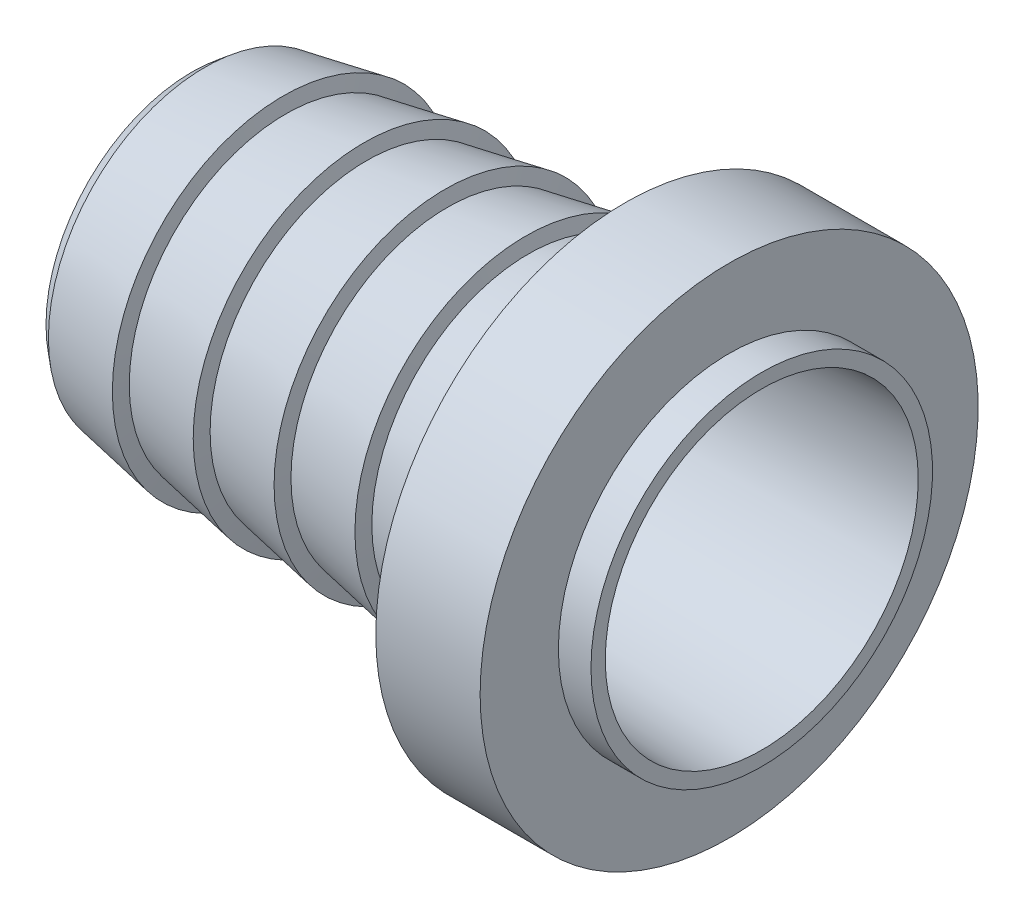
from build123d import *


with BuildPart() as part:
    # Sketch1 → Revolve2 (revolve)
    with BuildSketch(Plane(origin=(0, 0, 0), x_dir=(1, 0, 0), z_dir=(0, 1, 0)), mode=Mode.PRIVATE) as revolve2_sk:
        Polygon((0, 10.095412493), (0, 11.183615724), (1, 12), (7, 13.095445115), (7.2, 12), (13.2, 13.095445115), (13.4, 12), (19.4, 13.095445115), (19.6, 12), (25.6, 13.095445115), (25.8, 12), (31.8, 13.095445115), (33.2, 13.095445115), (33.2, 19.095445115), (41.2, 19.095445115), (41.2, 13.095445115), (43.7, 13.095445115), (43.7, 12), align=None)
    revolve(revolve2_sk.sketch.rotate(Axis((0, 0, 0), (1, 0, 0)), 180), axis=Axis((0, 0, 0), (1, 0, 0)))


solid = part.part
